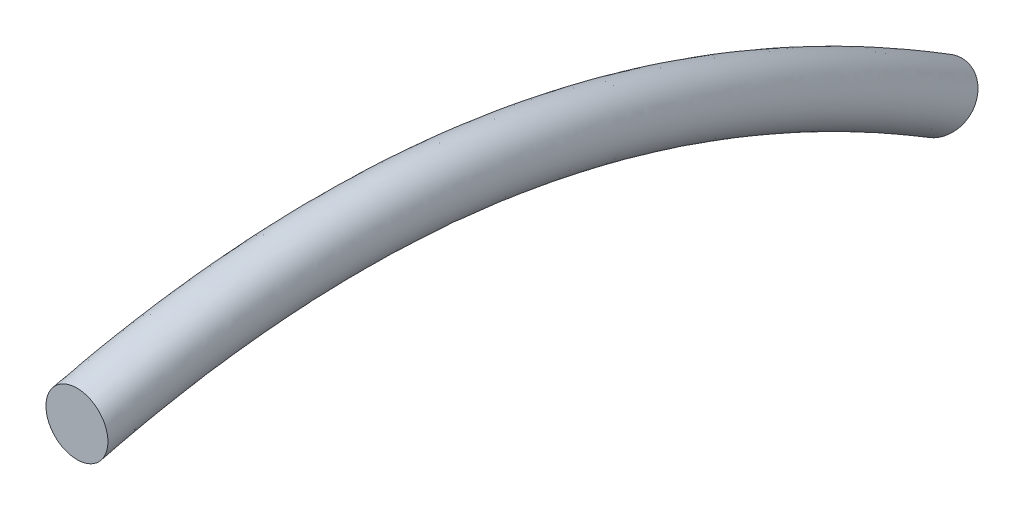
from build123d import *

# Parameters (mm, degrees)
SKETCH_1_R = 120


with BuildPart() as part:
    # 스윕1: sweep along a path in 스케치2
    with BuildLine() as sweep_1_path:  # in the path sketch's own coordinates; laid on its plane below (add() does not lay a ready-made edge on the line's plane)
        add(Edge.make_bspline(
            [(0, 0), (1712.954563045, 429.570524491), (3340.636423623, -571.106965417)],
            knots=[0, 0, 0, 1, 1, 1], degree=2))
    # 스케치1 → 스윕1 (sweep)
    with BuildSketch(Plane.XY):
        Circle(SKETCH_1_R)
    sweep(path=Plane(origin=(0, 0, 0), x_dir=(0, 0, -1), z_dir=(1, 0, 0)) * sweep_1_path.line)


solid = part.part
